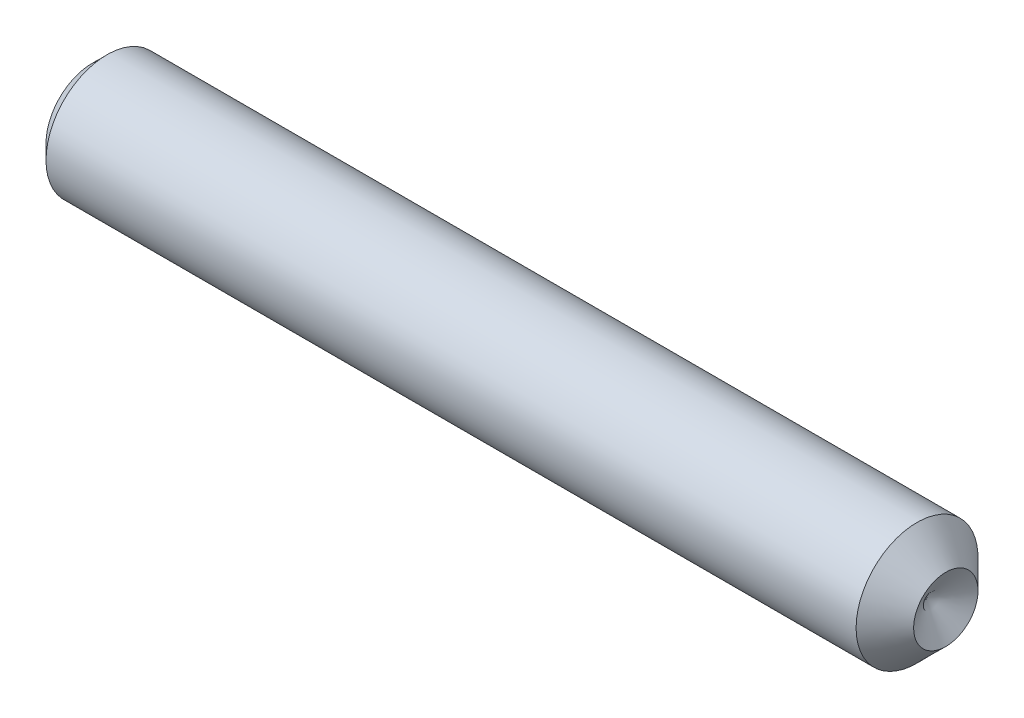
from build123d import *

# Parameters (mm, degrees)
HEX_2_DEPTH = 3.175


with BuildPart() as part:
    # BodySke → BaseBody (revolve)
    with BuildSketch(Plane.XY, mode=Mode.PRIVATE) as basebody_sk:
        Polygon((0, 0), (0, 2.41935), (0.75565, 3.175), (42.9514, 3.175), (44.45, 1.6764), (43.442717258, 0), align=None)
    revolve(basebody_sk.sketch.rotate(Axis((-12.7, 0, 0), (1, 0, 0)), 90), axis=Axis((-12.7, 0, 0), (1, 0, 0)))

    # Sketch2 → Hex 2 (cut)
    with BuildSketch(Plane.ZY):
        Polygon((0.916543552, 1.5875), (-0.916543552, 1.5875), (-1.833087105, 0), (-0.916543552, -1.5875), (0.916543552, -1.5875), (1.833087105, 0), align=None)
    extrude(amount=-HEX_2_DEPTH, mode=Mode.SUBTRACT)


solid = part.part
